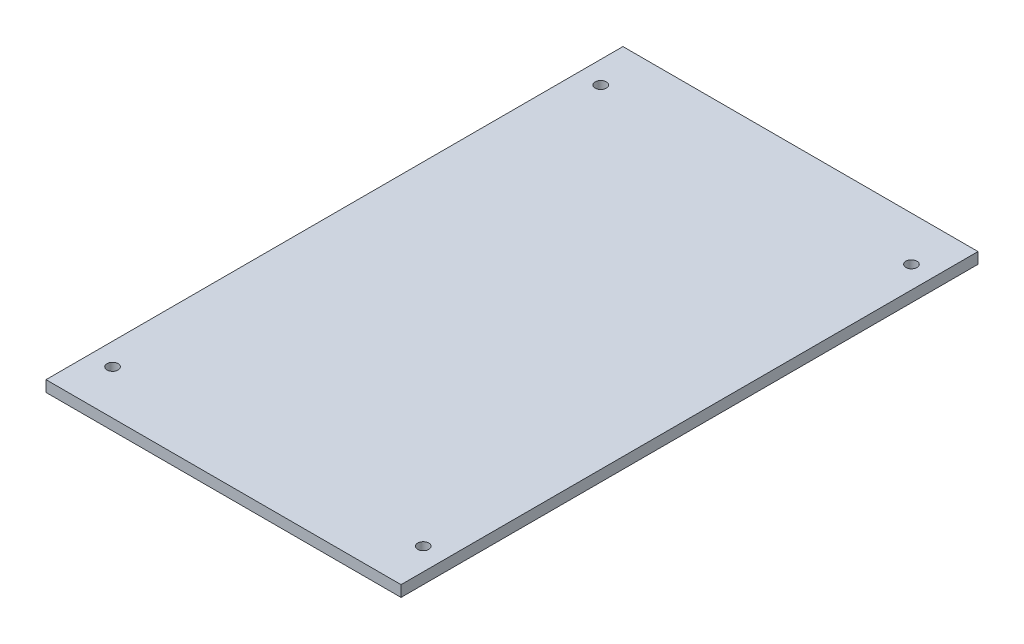
from build123d import *

# Parameters (mm, degrees)
SKETCH1_W               = 203.2
SKETCH1_H               = 330.2
BOSS_EXTRUDE1_DEPTH     = 6.35
CUT_EXTRUDE1_DEPTH      = 194.961059236
CUT_EXTRUDE1_DEPTH_BACK = 194.961059236
SKETCH2_R               = 3.175


with BuildPart() as part:
    # Sketch1 → Boss-Extrude1 (new body)
    with BuildSketch(Plane(origin=(0, 0, 0), x_dir=(1, 0, 0), z_dir=(0, 1, 0))):
        Rectangle(SKETCH1_W, SKETCH1_H)
    extrude(amount=BOSS_EXTRUDE1_DEPTH)

    # Sketch2 → Cut-Extrude1 (cut, two sides: drawn at the far end of the back side and taken through both)
    with BuildSketch(Plane(origin=(0, 6.35, 0), x_dir=(1, 0, 0), z_dir=(0, 1, 0)).offset(-CUT_EXTRUDE1_DEPTH_BACK)):
        with Locations(Location((88.9, 139.7, 0), (0, 0, 270))):
            Circle(SKETCH2_R)
        with Locations(Location((-88.9, 139.7, 0), (0, 0, 270))):
            Circle(SKETCH2_R)
        with Locations(Location((88.9, -139.7, 0), (0, 0, 270))):
            Circle(SKETCH2_R)
        with Locations(Location((-88.9, -139.7, 0), (0, 0, 270))):
            Circle(SKETCH2_R)
    extrude(amount=CUT_EXTRUDE1_DEPTH + CUT_EXTRUDE1_DEPTH_BACK, mode=Mode.SUBTRACT)


solid = part.part
